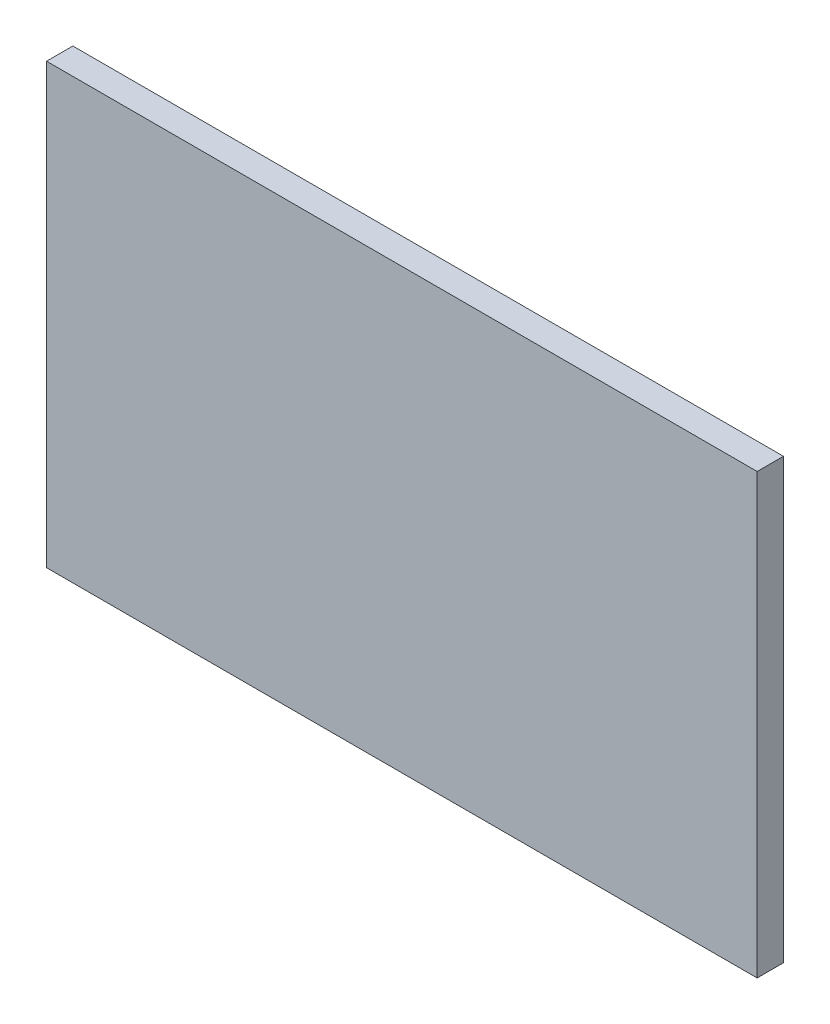
from build123d import *

# Parameters (mm, degrees)
ESQUISSE1_W             = 27
ESQUISSE1_H             = 16.667363
COMPONENT_OUTLINE_DEPTH = 1


with BuildPart() as part:
    # Esquisse1 → Component_Outline (new body)
    with BuildSketch(Plane.XY):
        with Locations((12.5, -7.6663185)):
            Rectangle(ESQUISSE1_W, ESQUISSE1_H)
    extrude(amount=COMPONENT_OUTLINE_DEPTH)


solid = part.part
